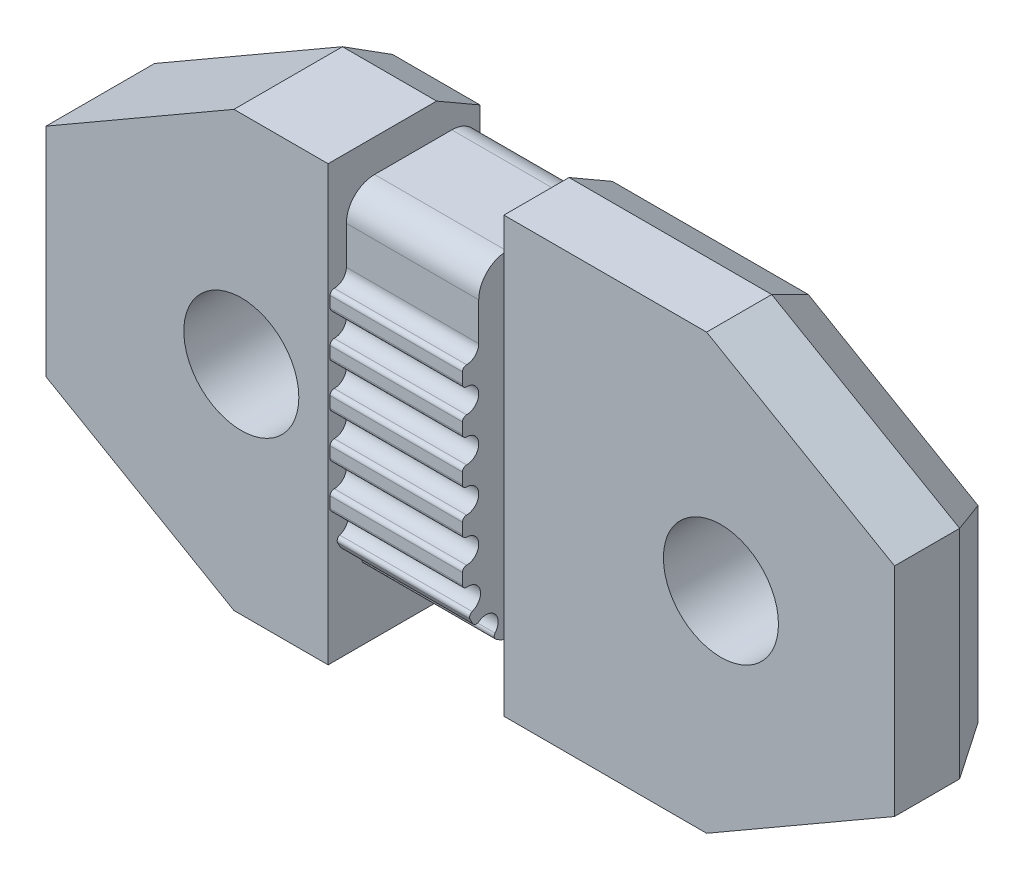
from build123d import *
from OCP.BRepFilletAPI import BRepFilletAPI_MakeChamfer

# Parameters (mm, degrees)
AUFSATZ_LINEAR_AUSTRAGEN1_DEPTH    = 6.1
SKIZZE1_W                          = 6
SKIZZE1_H                          = 15
AUFSATZ_LINEAR_AUSTRAGEN1_2_DEPTH  = 6.1
SKIZZE2_W                          = 6
SKIZZE2_H                          = 15
SCHNITT_LINEAR_AUSTRAGEN1_DEPTH    = 6.1
SKIZZE3_R                          = 2.65
AUFSATZ_LINEAR_AUSTRAGEN2_DEPTH    = 2.19
SCHNITT_LINEAR_AUSTRAGEN7_DEPTH    = 6.1
AUFSATZ_LINEAR_START               = 4.81
SKIZZE4_R                          = 2.65
AUFSATZ_LINEAR_AUSTRAGEN3_DEPTH    = 4.81
SKIZZE5_R                          = 2.65
AUFSATZ_LINEAR_AUSTRAGEN4_DEPTH    = 0.19
FASE1_SIZE                         = 5
FASE1_SIZE2                        = 8.660254038
FASE2_SIZE                         = 2
FASE2_SIZE2                        = 1.154700538
SCHNITT_LINEAR_START               = -14
SCHNITT_LINEAR_AUSTRAGEN8_DEPTH    = 2
SCHNITT_LINEAR_START_2             = -13.5
SCHNITT_LINEAR_AUSTRAGEN5_DEPTH    = 2.5
VERRUNDUNG1_R                      = 1.3
K_RPER_VERSCHIEBEN_KOPIEREN1_ANGLE = 90


with BuildPart() as part:
    # Skizze1 → Aufsatz-Linear austragen1 (new body)
    with BuildSketch(Plane.XY):
        with BuildLine():
            Line((-7.050000002, 7.568775844), (-7.050000002, 8.068775844))
            ThreePointArc((-7.050000002, 8.068775844), (-7.105649713, 8.203126132), (-7.240000002, 8.258775844))
            ThreePointArc((-7.240000002, 8.258775844), (-7.800000002, 8.818775844), (-7.240000002, 9.378775844))
            ThreePointArc((-7.240000002, 9.378775844), (-7.105649713, 9.434425555), (-7.050000002, 9.568775844))
            Line((-7.050000002, 9.568775844), (-7.050000002, 10.068775844))
            ThreePointArc((-7.050000002, 10.068775844), (-7.105649713, 10.203126132), (-7.240000002, 10.258775844))
            ThreePointArc((-7.240000002, 10.258775844), (-7.800000002, 10.818775844), (-7.240000002, 11.378775844))
            ThreePointArc((-7.240000002, 11.378775844), (-7.105649713, 11.434425555), (-7.050000002, 11.568775844))
            Line((-7.050000002, 11.568775844), (-7.050000002, 12.068775844))
            ThreePointArc((-7.050000002, 12.068775844), (-7.105649713, 12.203126132), (-7.240000002, 12.258775843))
            Line((-7.240000002, 12.258775843), (-9.150000002, 12.258775843))
            Line((-9.150000002, 12.258775843), (-9.150000002, 4))
            Line((-9.150000002, 4), (-10.615000002, 4))
            Line((-10.615000002, 4), (-13.960000002, 4))
            Line((-13.960000002, 4), (-13.960000002, 0.75))
            Line((-13.960000002, 0.75), (-11.613821225, 0.75))
            ThreePointArc((-11.613821225, 0.75), (-11.217841428, 0.585979797), (-11.053821225, 0.19))
            ThreePointArc((-11.053821225, 0.19), (-10.998171513, 0.055649712), (-10.863821225, 0))
            Line((-10.863821225, 0), (-10.615000002, 0))
            ThreePointArc((-10.615000002, 0), (-10.474650873, 0.002763747), (-10.334519354, 0.011050703))
            ThreePointArc((-10.334519354, 0.011050703), (-10.203241743, 0.079144265), (-10.160552613, 0.22073587))
            ThreePointArc((-10.160552613, 0.22073587), (-9.779942741, 0.876709768), (-9.094653704, 0.551833537))
            ThreePointArc((-9.094653704, 0.551833537), (-8.979253962, 0.459348706), (-8.832500002, 0.477619436))
            ThreePointArc((-8.832500002, 0.477619436), (-8.712335964, 0.550187475), (-8.595121987, 0.627429949))
            ThreePointArc((-8.595121987, 0.627429949), (-8.515479022, 0.752039509), (-8.549304953, 0.896006001))
            ThreePointArc((-8.549304953, 0.896006001), (-8.547674084, 1.654400997), (-7.791758254, 1.715694446))
            ThreePointArc((-7.791758254, 1.715694446), (-7.64557673, 1.693300104), (-7.527619437, 1.7825))
            ThreePointArc((-7.527619437, 1.7825), (-7.459838348, 1.905427785), (-7.396949303, 2.030928718))
            ThreePointArc((-7.396949303, 2.030928718), (-7.390281252, 2.178665245), (-7.491558614, 2.286430919))
            ThreePointArc((-7.491558614, 2.286430919), (-7.869343738, 2.944035686), (-7.24534815, 3.375075285))
            ThreePointArc((-7.24534815, 3.375075285), (-7.107554066, 3.428771978), (-7.050000002, 3.565))
            Line((-7.050000002, 3.565), (-7.050000002, 4.068775844))
            ThreePointArc((-7.050000002, 4.068775844), (-7.105649713, 4.203126132), (-7.240000002, 4.258775844))
            ThreePointArc((-7.240000002, 4.258775844), (-7.800000002, 4.818775844), (-7.240000002, 5.378775844))
            ThreePointArc((-7.240000002, 5.378775844), (-7.105649713, 5.434425555), (-7.050000002, 5.568775844))
            Line((-7.050000002, 5.568775844), (-7.050000002, 6.068775844))
            ThreePointArc((-7.050000002, 6.068775844), (-7.105649713, 6.203126132), (-7.240000002, 6.258775844))
            ThreePointArc((-7.240000002, 6.258775844), (-7.800000002, 6.818775844), (-7.240000002, 7.378775844))
            ThreePointArc((-7.240000002, 7.378775844), (-7.105649713, 7.434425555), (-7.050000002, 7.568775844))
        make_face()
    extrude(amount=AUFSATZ_LINEAR_AUSTRAGEN1_DEPTH)

    # Skizze3 → Aufsatz-Linear austragen2 (add)
    with BuildSketch(Plane.ZY.offset(9.150000002)):
        Polygon((6.1, 12.258775843), (6.1, 15.87), (0, 15.87), (0, 17.37), (-13, 17.37), (-13, -2.63), (0, -2.63), (0, 12.258775843), align=None)
        with Locations((-4, 7.37)):
            Circle(SKIZZE3_R, mode=Mode.SUBTRACT)
    extrude(amount=-AUFSATZ_LINEAR_AUSTRAGEN2_DEPTH)

    # Skizze15 → Schnitt-Linear austragen7 (cut)
    with BuildSketch(Plane.XY.offset(6.1)):
        with BuildLine():
            Line((-7.800000002, 12.818775843), (-7.800000002, 14.57))
            ThreePointArc((-7.800000002, 14.57), (-8.180761186, 15.489238816), (-9.100000002, 15.87))
            Line((-9.100000002, 15.87), (-6.960000002, 15.87))
            Line((-6.960000002, 15.87), (-6.960000002, 12.258775843))
            Line((-6.960000002, 12.258775843), (-7.240000002, 12.258775843))
            ThreePointArc((-7.240000002, 12.258775843), (-7.635979799, 12.422796046), (-7.800000002, 12.818775843))
        make_face()
    extrude(amount=-SCHNITT_LINEAR_AUSTRAGEN7_DEPTH, mode=Mode.SUBTRACT)

    # Skizze4 → Aufsatz-Linear austragen3 (add)
    with BuildSketch(Plane.ZY.offset(9.150000002).offset(AUFSATZ_LINEAR_START)):
        Polygon((6.1, 17.37), (6.1, 15.87), (0, 15.87), (0, 17.37), (-13, 17.37), (-13, -2.63), (0, -2.63), (0, 4), (6.1, 4), (6.1, -2.63), (24.1, -2.63), (24.1, 17.37), align=None)
        with Locations((16.1, 7.37)):
            Circle(SKIZZE4_R, mode=Mode.SUBTRACT)
        with Locations((-4, 7.37)):
            Circle(SKIZZE4_R, mode=Mode.SUBTRACT)
    extrude(amount=-AUFSATZ_LINEAR_AUSTRAGEN3_DEPTH)

    # Skizze5 → Aufsatz-Linear austragen4 (add)
    with BuildSketch(Plane(origin=(-9.150000002, 0, 0), x_dir=(0, 0, -1), z_dir=(1, 0, 0))):
        Polygon((-6.1, 17.37), (-24.1, 17.37), (-24.1, -2.63), (-6.1, -2.63), (-6.1, 0.655715781), (-6.1, 15.87), align=None)
        with Locations(Location((-16.1, 7.37, 0), (0, 0, 180))):
            Circle(SKIZZE5_R, mode=Mode.SUBTRACT)
    extrude(amount=AUFSATZ_LINEAR_AUSTRAGEN4_DEPTH)

    # Fase1: one chamfer whose edges measure the first distance from different faces: ONE call of the kernel's chamfer builder (chamfer() names one face for all edges)
    fase1_edges_1 = [part.edges().sort_by_distance(p)[0] for p in [
        (-10.460000002, -2.63, -13),
        (-10.460000002, 17.37, -13),
    ]]
    fase1_side_1 = [part.faces().sort_by_distance(p)[0] for p in [
        (-10.460000002, 7.37, -13),
    ]]
    fase1_edges_2 = [part.edges().sort_by_distance(p)[0] for p in [
        (-11.460000002, 17.37, 24.1),
        (-11.460000002, -2.63, 24.1),
    ]]
    fase1_side_2 = [part.faces().sort_by_distance(p)[0] for p in [
        (-11.460000002, 7.37, 24.1),
    ]]
    fase1 = BRepFilletAPI_MakeChamfer(part.part.solid().wrapped)
    for e in fase1_edges_1:
        fase1.Add(FASE1_SIZE, FASE1_SIZE2, e.wrapped, fase1_side_1[0].wrapped)  # the first distance lies on this face
    for e in fase1_edges_2:
        fase1.Add(FASE1_SIZE, FASE1_SIZE2, e.wrapped, fase1_side_2[0].wrapped)  # the first distance lies on this face
    add(Compound.cast(fase1.Shape()), mode=Mode.REPLACE)

    # Fase2: one chamfer whose edges measure the first distance from different faces: ONE call of the kernel's chamfer builder (chamfer() names one face for all edges)
    fase2_edges_1 = [part.edges().sort_by_distance(p)[0] for p in [
        (-13.960000002, 17.37, 10.769872981),
    ]]
    fase2_side_1 = [part.faces().sort_by_distance(p)[0] for p in [
        (-11.460000002, 17.37, 10.769872981),
    ]]
    fase2_edges_2 = [part.edges().sort_by_distance(p)[0] for p in [
        (-13.960000002, 17.37, -2.169872981),
    ]]
    fase2_side_2 = [part.faces().sort_by_distance(p)[0] for p in [
        (-10.460000002, 17.37, -2.169872981),
    ]]
    fase2_edges_3 = [part.edges().sort_by_distance(p)[0] for p in [
        (-13.960000002, -2.63, 10.769872981),
    ]]
    fase2_side_3 = [part.faces().sort_by_distance(p)[0] for p in [
        (-11.460000002, -2.63, 10.769872981),
    ]]
    fase2_edges_4 = [part.edges().sort_by_distance(p)[0] for p in [
        (-13.960000002, 7.37, 24.1),
    ]]
    fase2_side_4 = [part.faces().sort_by_distance(p)[0] for p in [
        (-11.460000002, 7.37, 24.1),
    ]]
    fase2_edges_5 = [part.edges().sort_by_distance(p)[0] for p in [
        (-13.960000002, 7.37, -13),
    ]]
    fase2_side_5 = [part.faces().sort_by_distance(p)[0] for p in [
        (-10.460000002, 7.37, -13),
    ]]
    fase2_edges_6 = [part.edges().sort_by_distance(p)[0] for p in [
        (-13.960000002, -2.63, -2.169872981),
    ]]
    fase2_side_6 = [part.faces().sort_by_distance(p)[0] for p in [
        (-10.460000002, -2.63, -2.169872981),
    ]]
    fase2_edges_7 = [part.edges().sort_by_distance(p)[0] for p in [
        (-13.960000002, -0.13, -8.669872981),
    ]]
    fase2_side_7 = [part.faces().sort_by_distance(p)[0] for p in [
        (-10.460000002, -0.13, -8.669872981),
    ]]
    fase2_edges_8 = [part.edges().sort_by_distance(p)[0] for p in [
        (-13.960000002, -0.13, 19.769872981),
    ]]
    fase2_side_8 = [part.faces().sort_by_distance(p)[0] for p in [
        (-11.460000002, -0.13, 19.769872981),
    ]]
    fase2_edges_9 = [part.edges().sort_by_distance(p)[0] for p in [
        (-13.960000002, 14.87, -8.669872981),
    ]]
    fase2_side_9 = [part.faces().sort_by_distance(p)[0] for p in [
        (-10.460000002, 14.87, -8.669872981),
    ]]
    fase2_edges_10 = [part.edges().sort_by_distance(p)[0] for p in [
        (-13.960000002, 14.87, 19.769872981),
    ]]
    fase2_side_10 = [part.faces().sort_by_distance(p)[0] for p in [
        (-11.460000002, 14.87, 19.769872981),
    ]]
    fase2 = BRepFilletAPI_MakeChamfer(part.part.solid().wrapped)
    for e in fase2_edges_1:
        fase2.Add(FASE2_SIZE, FASE2_SIZE2, e.wrapped, fase2_side_1[0].wrapped)  # the first distance lies on this face
    for e in fase2_edges_2:
        fase2.Add(FASE2_SIZE, FASE2_SIZE2, e.wrapped, fase2_side_2[0].wrapped)  # the first distance lies on this face
    for e in fase2_edges_3:
        fase2.Add(FASE2_SIZE, FASE2_SIZE2, e.wrapped, fase2_side_3[0].wrapped)  # the first distance lies on this face
    for e in fase2_edges_4:
        fase2.Add(FASE2_SIZE, FASE2_SIZE2, e.wrapped, fase2_side_4[0].wrapped)  # the first distance lies on this face
    for e in fase2_edges_5:
        fase2.Add(FASE2_SIZE, FASE2_SIZE2, e.wrapped, fase2_side_5[0].wrapped)  # the first distance lies on this face
    for e in fase2_edges_6:
        fase2.Add(FASE2_SIZE, FASE2_SIZE2, e.wrapped, fase2_side_6[0].wrapped)  # the first distance lies on this face
    for e in fase2_edges_7:
        fase2.Add(FASE2_SIZE, FASE2_SIZE2, e.wrapped, fase2_side_7[0].wrapped)  # the first distance lies on this face
    for e in fase2_edges_8:
        fase2.Add(FASE2_SIZE, FASE2_SIZE2, e.wrapped, fase2_side_8[0].wrapped)  # the first distance lies on this face
    for e in fase2_edges_9:
        fase2.Add(FASE2_SIZE, FASE2_SIZE2, e.wrapped, fase2_side_9[0].wrapped)  # the first distance lies on this face
    for e in fase2_edges_10:
        fase2.Add(FASE2_SIZE, FASE2_SIZE2, e.wrapped, fase2_side_10[0].wrapped)  # the first distance lies on this face
    add(Compound.cast(fase2.Shape()), mode=Mode.REPLACE)

    # Skizze11 → Schnitt-Linear austragen8 (cut)
    with BuildSketch(Plane.XZ.offset(2.63).offset(SCHNITT_LINEAR_START)):
        with BuildLine():
            Line((-13.960000002, 7.6), (-13.960000002, 6.1))
            ThreePointArc((-13.960000002, 6.1), (-12.89933983, 5.660660172), (-12.460000002, 4.6))
            Line((-12.460000002, 4.6), (-12.460000002, 1.5))
            ThreePointArc((-12.460000002, 1.5), (-12.89933983, 0.439339828), (-13.960000002, 0))
            Line((-13.960000002, 0), (-13.960000002, -1.5))
            ThreePointArc((-13.960000002, -1.5), (-11.838679658, -0.621320344), (-10.960000002, 1.5))
            Line((-10.960000002, 1.5), (-10.960000002, 4.6))
            ThreePointArc((-10.960000002, 4.6), (-11.838679658, 6.721320344), (-13.960000002, 7.6))
        make_face()
    extrude(amount=-SCHNITT_LINEAR_AUSTRAGEN8_DEPTH, mode=Mode.SUBTRACT)

    # Skizze13 → Schnitt-Linear austragen5 (cut)
    with BuildSketch(Plane.XY.offset(24.1).offset(SCHNITT_LINEAR_START_2)):
        with BuildLine():
            Line((-12.960000002, 5.37), (-12.960000002, 9.37))
            ThreePointArc((-12.960000002, 9.37), (-13.252893221, 10.077106781), (-13.960000002, 10.37))
            Line((-13.960000002, 10.37), (-13.960000002, 11.87))
            ThreePointArc((-13.960000002, 11.87), (-12.192233049, 11.137766953), (-11.460000002, 9.37))
            Line((-11.460000002, 9.37), (-11.460000002, 5.37))
            ThreePointArc((-11.460000002, 5.37), (-12.192233049, 3.602233047), (-13.960000002, 2.87))
            Line((-13.960000002, 2.87), (-13.960000002, 4.37))
            ThreePointArc((-13.960000002, 4.37), (-13.252893221, 4.662893219), (-12.960000002, 5.37))
        make_face()
    extrude(amount=-SCHNITT_LINEAR_AUSTRAGEN5_DEPTH, mode=Mode.SUBTRACT)

    # Verrundung1
    verrundung1_edges = [part.edges().sort_by_distance(p)[0] for p in [
        (-13.960000002, 15.87, 3.05),
    ]]
    fillet(verrundung1_edges, radius=VERRUNDUNG1_R)


with BuildPart() as body_2:
    # Skizze1 → Aufsatz-Linear austragen1 2 (new body)
    with BuildSketch(Plane.XY):
        with Locations((-3, 7.5)):
            Rectangle(SKIZZE1_W, SKIZZE1_H)
    extrude(amount=AUFSATZ_LINEAR_AUSTRAGEN1_2_DEPTH)

    # Skizze2 → Schnitt-Linear austragen1 (cut)
    with BuildSketch(Plane.XY.offset(6.1)):
        with Locations((-3, 7.5)):
            Rectangle(SKIZZE2_W, SKIZZE2_H)
    extrude(amount=-SCHNITT_LINEAR_AUSTRAGEN1_DEPTH, mode=Mode.SUBTRACT)


with BuildPart() as body_2_2:
    # Spiegeln1: mirrored copy
    add(part.part.mirror(Plane(origin=(-6.960000002, -14.282117533, -13), x_dir=(1, 0, 0), z_dir=(0, 0, 1))))


with BuildPart() as body_2_2_1:
    # Körper-Verschieben/Kopieren1: moved
    add(body_2_2.part.rotate(Axis((-10.55, 0, 5.55), (0, -1, 0)), K_RPER_VERSCHIEBEN_KOPIEREN1_ANGLE))


solid = body_2_2_1.part
